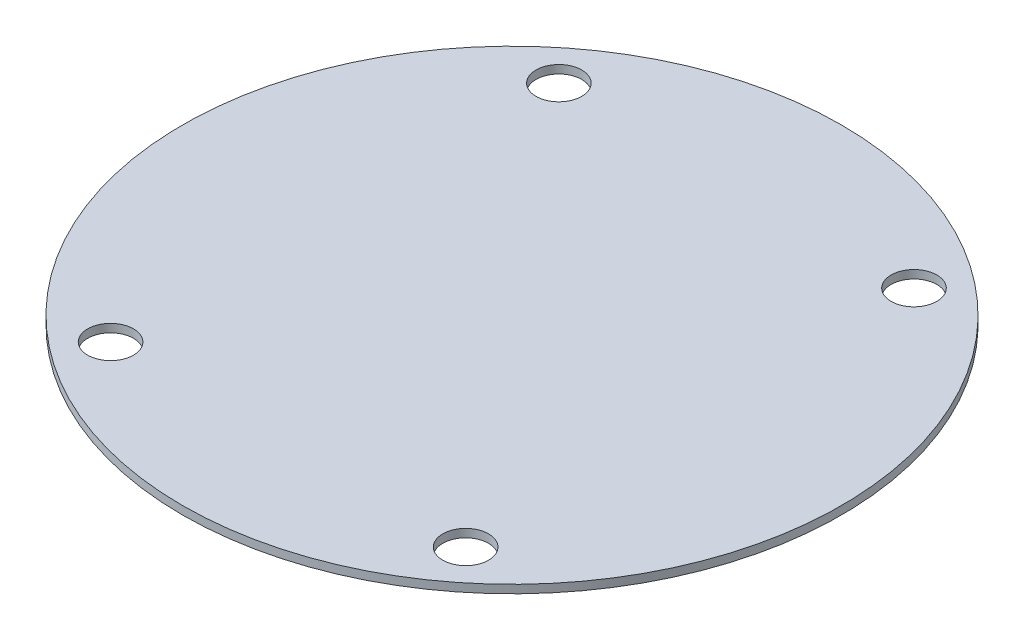
from build123d import *

# Parameters (mm, degrees)
SKETCH1_R           = 40
BOSS_EXTRUDE1_DEPTH = 1
SKETCH2_R           = 2.775
CUT_EXTRUDE4_DEPTH  = 57.577380639


with BuildPart() as part:
    # Sketch1 → Boss-Extrude1 (new body)
    with BuildSketch(Plane(origin=(0, 0, 0), x_dir=(1, 0, 0), z_dir=(0, 1, 0))):
        with Locations(Location((0, 0, 0), (0, 0, 270))):
            Circle(SKETCH1_R)
    extrude(amount=BOSS_EXTRUDE1_DEPTH)

    # Sketch2 → Cut-Extrude4 (cut, through all)
    with BuildSketch(Plane(origin=(0, 0, 0), x_dir=(-1, 0, 0), z_dir=(0, -1, 0))):
        with Locations(Location((21.55, -27.174191964, 0), (0, 0, 90))):
            Circle(SKETCH2_R)
        with Locations(Location((-21.55, -27.174191964, 0), (0, 0, 90))):
            Circle(SKETCH2_R)
        with Locations(Location((21.55, 27.240932193, 0), (0, 0, 90))):
            Circle(SKETCH2_R)
        with Locations(Location((-21.55, 27.240932193, 0), (0, 0, 90))):
            Circle(SKETCH2_R)
    extrude(amount=-CUT_EXTRUDE4_DEPTH, mode=Mode.SUBTRACT)


solid = part.part
